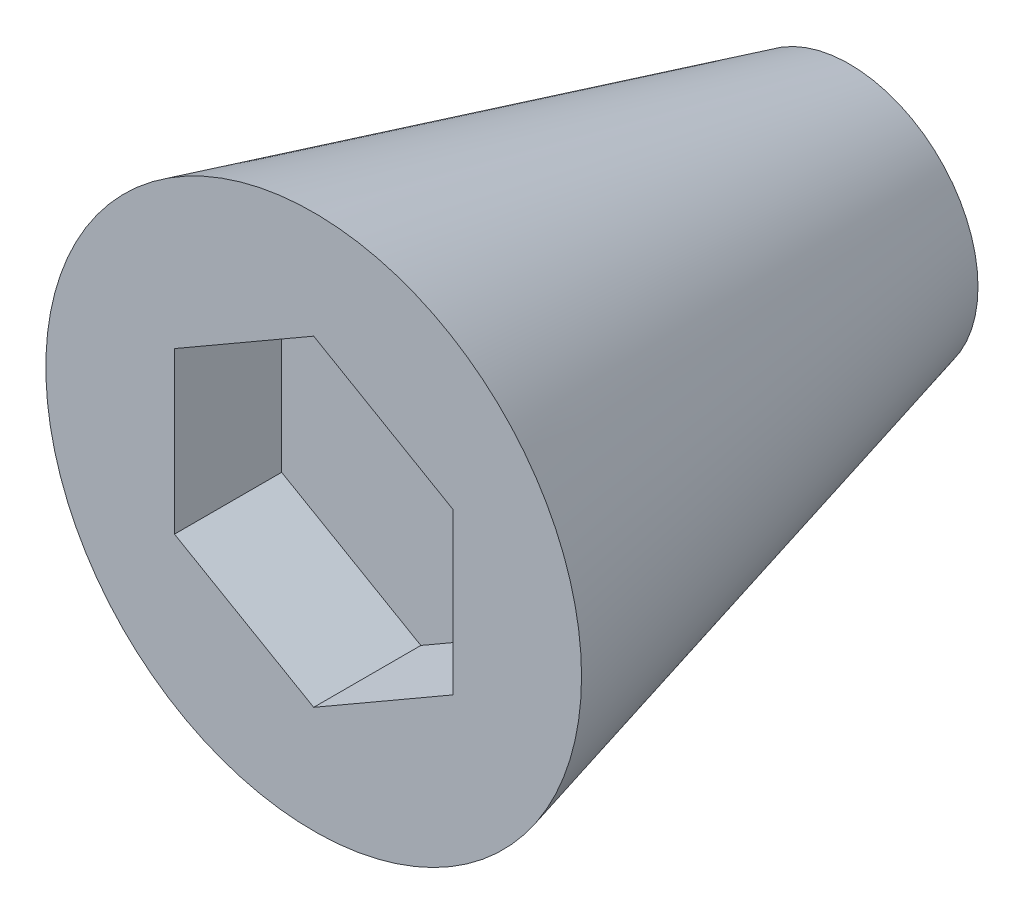
from build123d import *

# Parameters (mm, degrees)
CUT_EXTRUDE_1_DEPTH = 5
CUT_EXTRUDE_2_DEPTH = 10


with BuildPart() as part:
    # 草图1 → 旋转1 (revolve)
    with BuildSketch(Plane(origin=(0, 0, 0), x_dir=(1, 0, 0), z_dir=(0, 1, 0))):
        Polygon((12, 50), (0, 50), (0, 20), (19.8, 20), align=None)
        Polygon((19.8, 20), (0, 20), (0, 0), (25, 0), align=None)
    revolve(axis=Axis((0, 0, 0), (0, 0, -1)))

    # 草图2 → 切除-拉伸1 (cut)
    with BuildSketch(Plane(origin=(0, 0, -50), x_dir=(-1, 0, 0), z_dir=(0, 0, -1))):
        Polygon((0, 6.92820323), (-6, 3.464101615), (-6, -3.464101615), (0, -6.92820323), (6, -3.464101615), (6, 3.464101615), align=None)
    extrude(amount=-CUT_EXTRUDE_1_DEPTH, mode=Mode.SUBTRACT)

    # 草图3 → 切除-拉伸2 (cut)
    with BuildSketch(Plane.XY):
        Polygon((0, 15), (-12.990381057, 7.5), (-12.990381057, -7.5), (0, -15), (12.990381057, -7.5), (12.990381057, 7.5), align=None)
    extrude(amount=-CUT_EXTRUDE_2_DEPTH, mode=Mode.SUBTRACT)


solid = part.part
